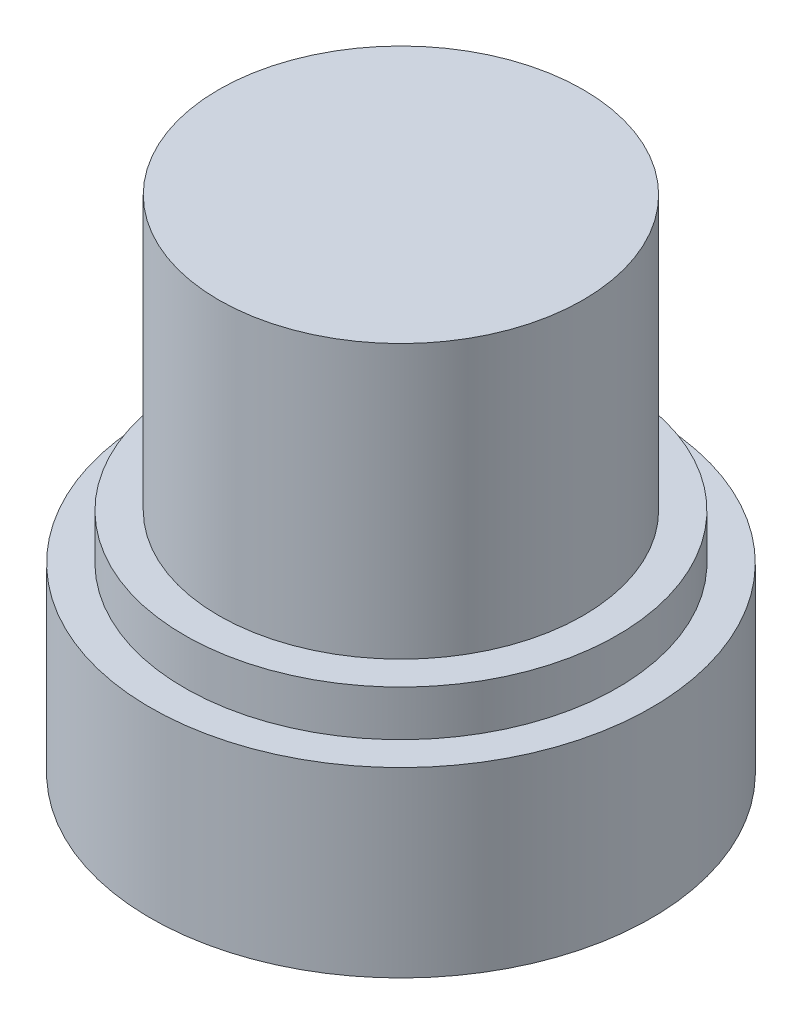
from build123d import *


with BuildPart() as part:
    # Sketch1 → Revolve1 (revolve)
    with BuildSketch(Plane.XY, mode=Mode.PRIVATE) as revolve1_sk:
        Polygon((0, 0), (2.75, 0), (2.75, 2), (2.375, 2), (2.375, 2.5), (2, 2.5), (2, 5.5), (0, 5.5), align=None)
    revolve(revolve1_sk.sketch.rotate(Axis((0, 5.5, 0), (0, -1, 0)), 180), axis=Axis((0, 5.5, 0), (0, -1, 0)))


solid = part.part
